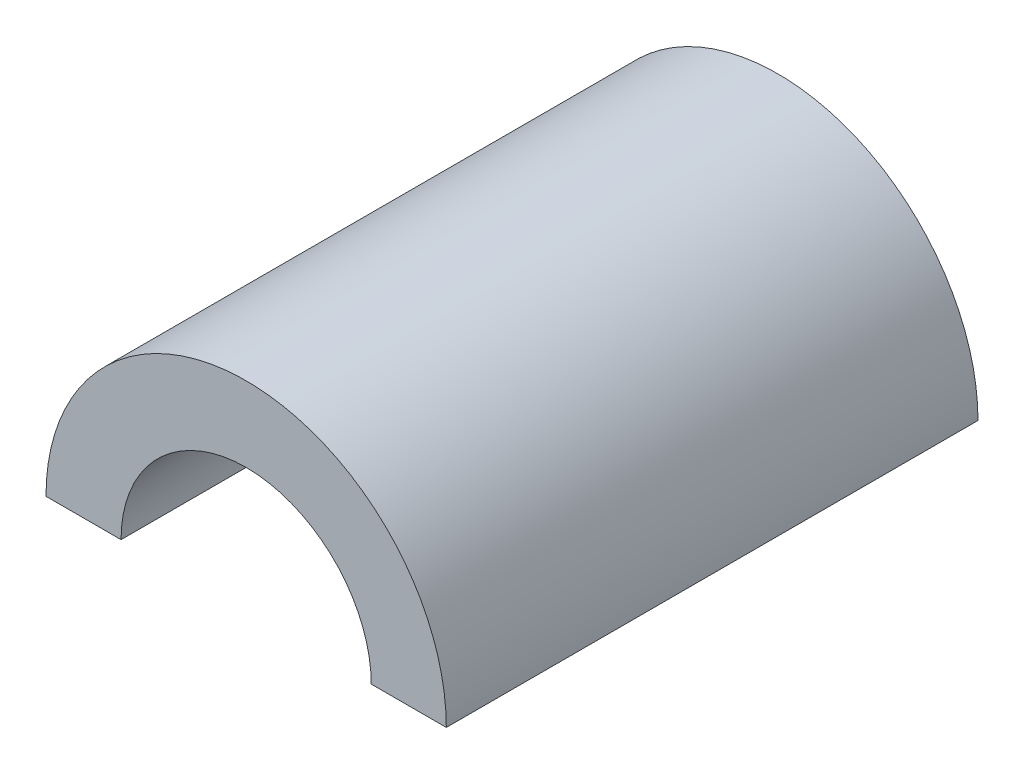
from build123d import *

# Parameters (mm, degrees)
EXTRUDE_THIN2_DEPTH = 85


with BuildPart() as part:
    # Sketch1 → Extrude-Thin2 (new body)
    with BuildSketch(Plane.XY):
        with BuildLine():
            ThreePointArc((0, 0), (32, 32), (64, 0))
            Line((64, 0), (52, 0))
            ThreePointArc((52, 0), (32, 20), (12, 0))
            Line((12, 0), (0, 0))
        make_face()
    extrude(amount=-EXTRUDE_THIN2_DEPTH)


solid = part.part
